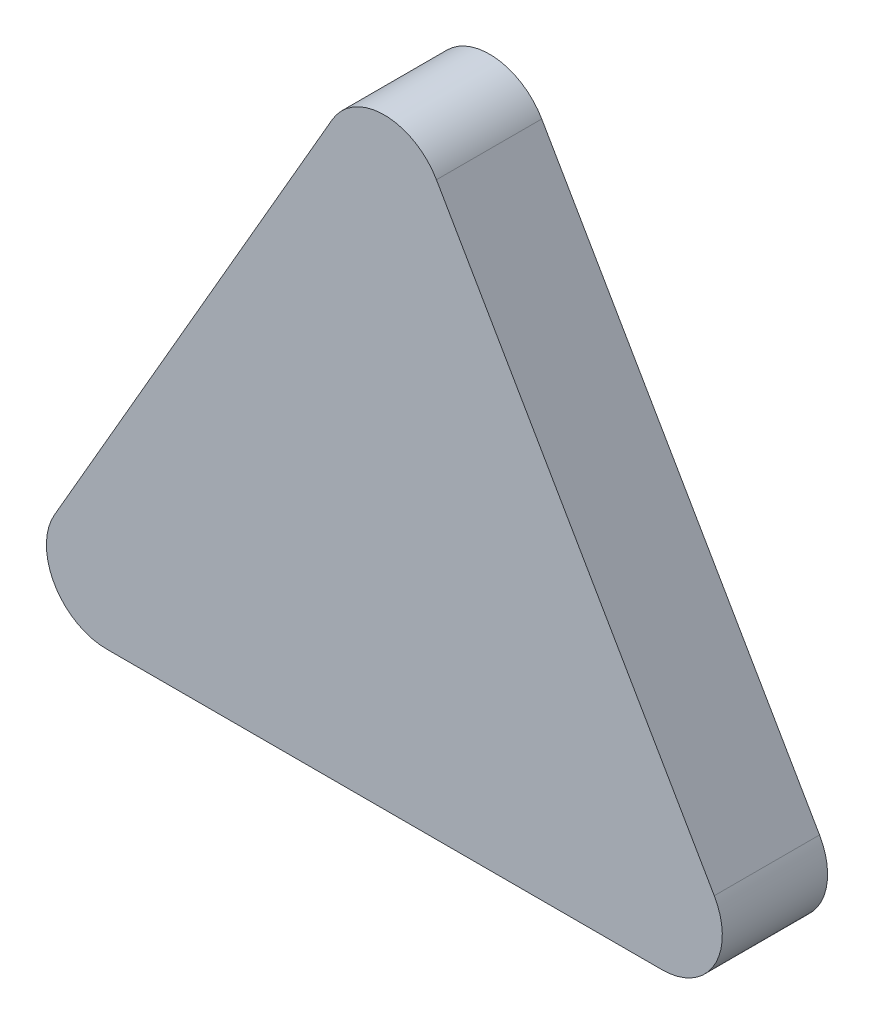
from build123d import *

# Parameters (mm, degrees)
BOSS_EXTRU_1_DEPTH = 3.5
CONG_1_R           = 2


with BuildPart() as part:
    # Esquisse1 → Boss.-Extru.1 (new body)
    with BuildSketch(Plane.XY):
        Polygon((-12.7, 0), (12.7, 0), (0, 21.997045256), align=None)
    extrude(amount=BOSS_EXTRU_1_DEPTH)

    # Congé1
    cong_1_edges = [part.edges().sort_by_distance(p)[0] for p in [
        (0, 21.997045256, 1.75),
        (12.7, 0, 1.75),
        (-12.7, 0, 1.75),
    ]]
    fillet(cong_1_edges, radius=CONG_1_R)


solid = part.part
